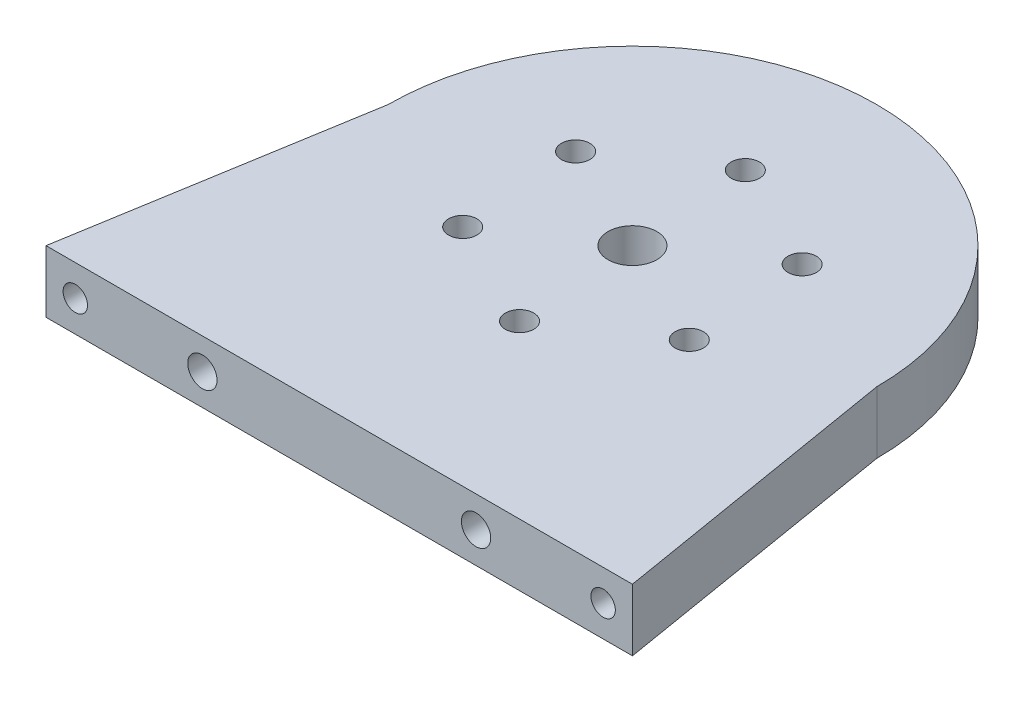
from build123d import *

# Parameters (mm, degrees)
PLACA_J5_START           = -3.175
PLACA_J5_DEPTH           = 6.35
PLACA_J5_REDONDEO_START  = -3.175
CROQUIS9_R               = 25
PLACA_J5_REDONDEO_DEPTH  = 6.35
BARRENOS_SALIDA_M5_START = -3.175
CROQUIS10_R              = 1.45
CROQUIS10_R_2            = 2.5
BARRENOS_SALIDA_M5_DEPTH = 6.35
REFRENTADO_M2_5_START    = -3.175
CROQUIS11_R              = 2.5
REFRENTADO_M2_5_DEPTH    = 2.6
ROSCA_M3_CANTO_START     = 357.55
CROQUIS12_R              = 1.25
ROSCA_M3_CANTO_DEPTH     = 9
PASADORES_D3_START       = 359.55
CROQUIS13_R              = 1.5
PASADORES_D3_DEPTH       = 7


with BuildPart() as part:
    # Croquis8 → Placa_J5 (new body)
    with BuildSketch(Plane(origin=(0, 0, 0), x_dir=(1, 0, 0), z_dir=(0, 1, 0)).offset(PLACA_J5_START)):
        Polygon((127.4, -336.55), (177.4, -336.55), (182.4, -366.55), (122.4, -366.55), align=None)
    extrude(amount=PLACA_J5_DEPTH)

    # Croquis9 → Placa_J5_redondeo (add)
    with BuildSketch(Plane(origin=(0, 0, 0), x_dir=(1, 0, 0), z_dir=(0, 1, 0)).offset(PLACA_J5_REDONDEO_START)):
        with Locations((152.4, -336.55)):
            Circle(CROQUIS9_R)
    extrude(amount=PLACA_J5_REDONDEO_DEPTH)

    # Croquis10 → Barrenos_salida_M5 (cut)
    with BuildSketch(Plane(origin=(0, 0, 0), x_dir=(1, 0, 0), z_dir=(0, 1, 0)).offset(BARRENOS_SALIDA_M5_START)):
        with Locations((163.653984643, -341.990388742)):
            Circle(CROQUIS10_R)
        with Locations((153.315477464, -349.016430965)):
            Circle(CROQUIS10_R)
        with Locations((142.061492822, -343.576042223)):
            Circle(CROQUIS10_R)
        with Locations((141.146015357, -331.109611258)):
            Circle(CROQUIS10_R)
        with Locations((151.484522536, -324.083569035)):
            Circle(CROQUIS10_R)
        with Locations((162.738507178, -329.523957777)):
            Circle(CROQUIS10_R)
        with Locations((152.4, -336.55)):
            Circle(CROQUIS10_R_2)
    extrude(amount=BARRENOS_SALIDA_M5_DEPTH, mode=Mode.SUBTRACT)

    # Croquis11 → Refrentado_M2-5 (cut)
    with BuildSketch(Plane(origin=(0, 0, 0), x_dir=(1, 0, 0), z_dir=(0, 1, 0)).offset(REFRENTADO_M2_5_START)):
        with Locations((163.653984643, -341.990388742)):
            Circle(CROQUIS11_R)
        with Locations((153.315477464, -349.016430965)):
            Circle(CROQUIS11_R)
        with Locations((142.061492822, -343.576042223)):
            Circle(CROQUIS11_R)
        with Locations((141.146015357, -331.109611258)):
            Circle(CROQUIS11_R)
        with Locations((151.484522536, -324.083569035)):
            Circle(CROQUIS11_R)
        with Locations((162.738507178, -329.523957777)):
            Circle(CROQUIS11_R)
    extrude(amount=REFRENTADO_M2_5_DEPTH, mode=Mode.SUBTRACT)

    # Croquis12 → Rosca_M3_canto (cut)
    with BuildSketch(Plane.XY.offset(ROSCA_M3_CANTO_START)):
        with Locations((125.4, 0)):
            Circle(CROQUIS12_R)
        with Locations((179.4, 0)):
            Circle(CROQUIS12_R)
    extrude(amount=ROSCA_M3_CANTO_DEPTH, mode=Mode.SUBTRACT)

    # Croquis13 → Pasadores_D3 (cut)
    with BuildSketch(Plane.XY.offset(PASADORES_D3_START)):
        with Locations((138.4, 0)):
            Circle(CROQUIS13_R)
        with Locations((166.4, 0)):
            Circle(CROQUIS13_R)
    extrude(amount=PASADORES_D3_DEPTH, mode=Mode.SUBTRACT)


solid = part.part
